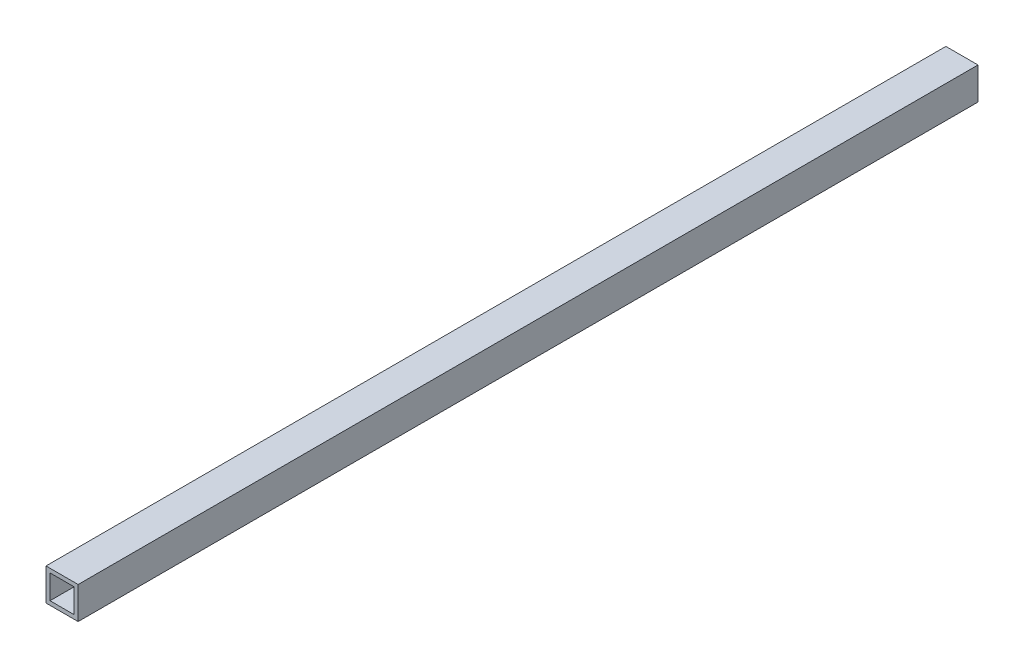
from build123d import *

# Parameters (mm, degrees)
SKETCH1_W           = 25.4
SKETCH1_H           = 25.4
SKETCH1_W_2         = 19.05
SKETCH1_H_2         = 19.05
BOSS_EXTRUDE1_DEPTH = 711.2


with BuildPart() as part:
    # Sketch1 → Boss-Extrude1 (new body)
    with BuildSketch(Plane.XY):
        with Locations((12.7, 12.7)):
            Rectangle(SKETCH1_W, SKETCH1_H)
        with Locations((12.7, 12.7)):
            Rectangle(SKETCH1_W_2, SKETCH1_H_2, mode=Mode.SUBTRACT)
    extrude(amount=BOSS_EXTRUDE1_DEPTH)


solid = part.part
